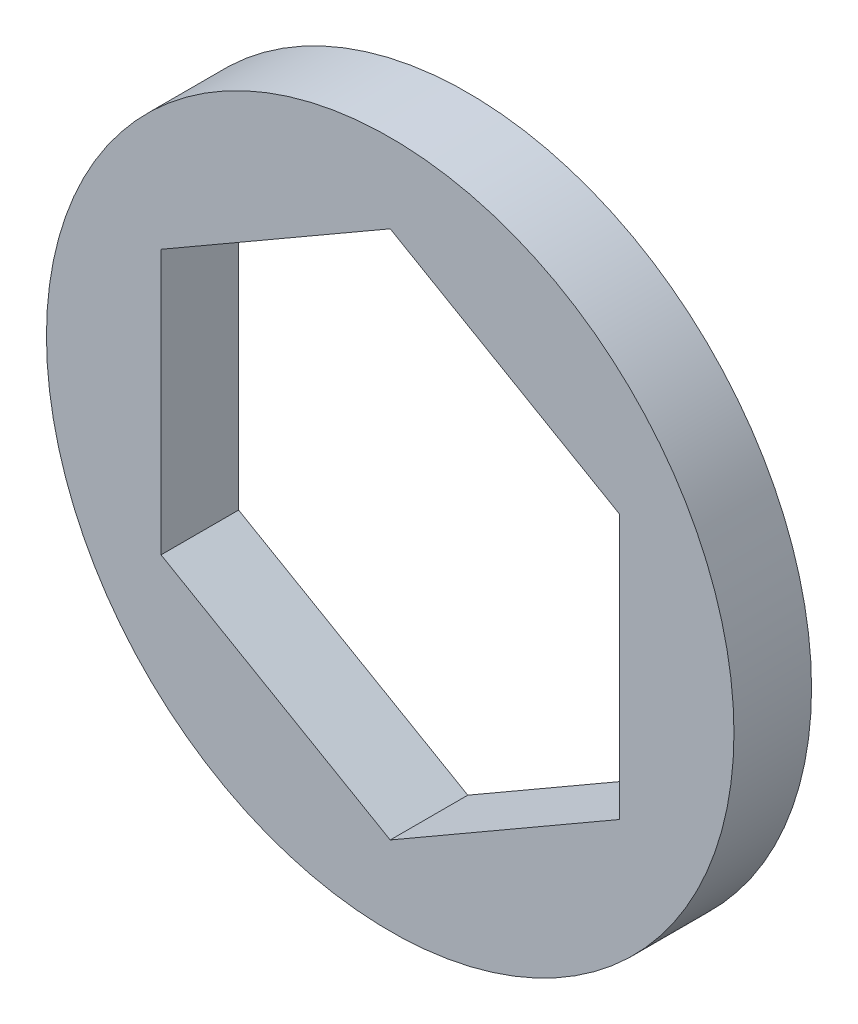
from build123d import *

# Parameters (mm, degrees)
SKETCH1_R           = 9.525
BOSS_EXTRUDE1_DEPTH = 1.074801


with BuildPart() as part:
    # Sketch1 → Boss-Extrude1 (new, symmetric)
    with BuildSketch(Plane.XY):
        Circle(SKETCH1_R)
        Polygon((0, 7.332348419), (-6.35, 3.666174209), (-6.35, -3.666174209), (0, -7.332348419), (6.35, -3.666174209), (6.35, 3.666174209), align=None, mode=Mode.SUBTRACT)
    extrude(amount=BOSS_EXTRUDE1_DEPTH, both=True)


solid = part.part
